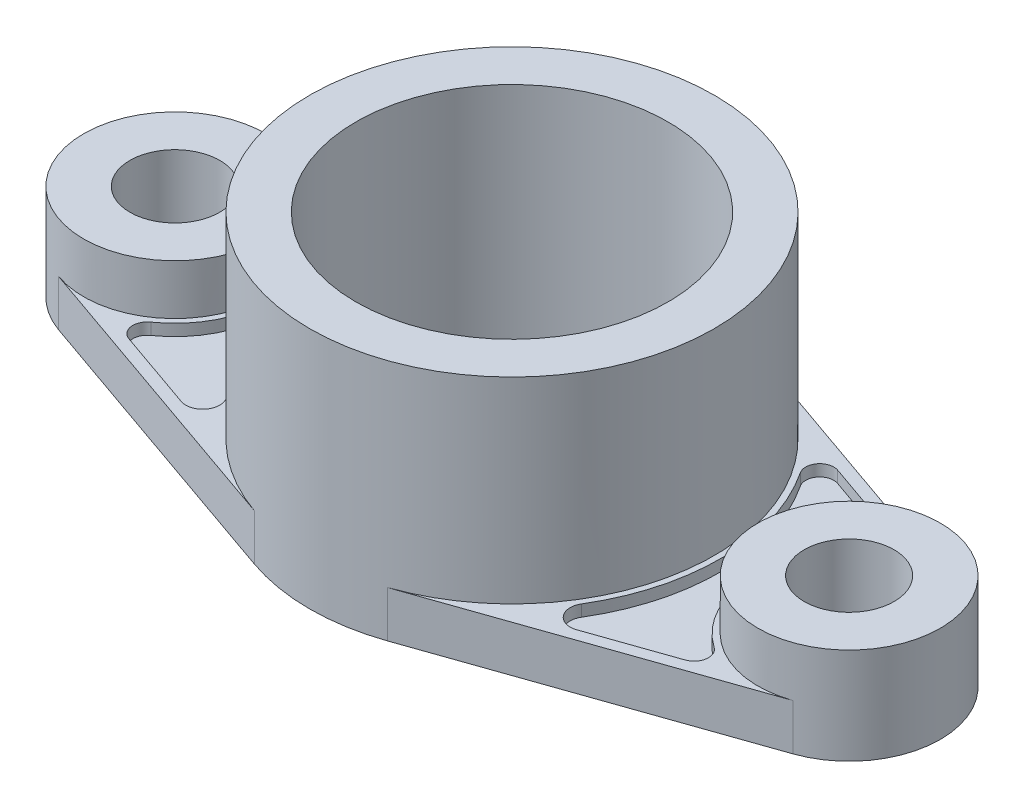
from build123d import *

# Parameters (mm, degrees)
BOSS_EXTRUDE1_DEPTH   = 12
BOSS_EXTRUDE1_2_DEPTH = 12
BOSS_EXTRUDE2_DEPTH   = 9
SKETCH1_4_R           = 40.5
BOSS_EXTRUDE3_DEPTH   = 63
SKETCH1_5_R           = 23.665
SKETCH1_5_R_2         = 11.665
BOSS_EXTRUDE4_DEPTH   = 25


with BuildPart() as part:
    # Sketch1 → Boss-Extrude1 (new body)
    with BuildSketch(Plane(origin=(0, 0, 0), x_dir=(1, 0, 0), z_dir=(0, 1, 0))):
        with BuildLine():
            ThreePointArc((-17.301, -49.56738241), (-52.5, 0), (-17.301, 49.56738241))
            Line((-17.301, 49.56738241), (-95.298631714, 22.343087709))
            ThreePointArc((-95.298631714, 22.343087709), (-63.835, 0), (-95.298631714, -22.343087709))
            Line((-95.298631714, -22.343087709), (-17.301, -49.56738241))
        make_face()
        with BuildLine():
            Line((-73.061565244, 26.927220983), (-49.292435481, 35.22359844))
            ThreePointArc((-49.292435481, 35.22359844), (-45.21504533, 34.020913269), (-45.050715916, 29.773024628))
            ThreePointArc((-45.050715916, 29.773024628), (-53.990744033, 0.999779365), (-46.122102919, -28.084722223))
            ThreePointArc((-46.122102919, -28.084722223), (-46.457803099, -33.130049608), (-51.320741116, -34.515638607))
            Line((-51.320741116, -34.515638607), (-72.196764974, -27.229070884))
            ThreePointArc((-72.196764974, -27.229070884), (-74.665998298, -24.211578828), (-73.102729075, -20.639666056))
            ThreePointArc((-73.102729075, -20.639666056), (-62.338211107, 0.40200089), (-73.769413903, 21.089054754))
            ThreePointArc((-73.769413903, 21.089054754), (-75.234080861, 24.22863303), (-73.061565244, 26.927220983))
        make_face(mode=Mode.SUBTRACT)
    extrude(amount=BOSS_EXTRUDE1_DEPTH)



with BuildPart() as body_2:
    # Sketch1 → Boss-Extrude1 2 (new body)
    with BuildSketch(Plane(origin=(0, 0, 0), x_dir=(1, 0, 0), z_dir=(0, 1, 0))):
        with BuildLine():
            Line((95.298631714, 22.343087709), (17.301, 49.56738241))
            ThreePointArc((17.301, 49.56738241), (52.5, 0), (17.301, -49.56738241))
            Line((17.301, -49.56738241), (95.298631714, -22.343087709))
            ThreePointArc((95.298631714, -22.343087709), (63.835, 0), (95.298631714, 22.343087709))
        make_face()
        with BuildLine():
            ThreePointArc((73.102729075, -20.639666056), (74.665998298, -24.211578828), (72.196764974, -27.229070884))
            Line((72.196764974, -27.229070884), (51.320741116, -34.515638607))
            ThreePointArc((51.320741116, -34.515638607), (46.457803099, -33.130049608), (46.122102919, -28.084722223))
            ThreePointArc((46.122102919, -28.084722223), (53.990744033, 0.999779365), (45.050715916, 29.773024628))
            ThreePointArc((45.050715916, 29.773024628), (45.21504533, 34.020913269), (49.292435481, 35.22359844))
            Line((49.292435481, 35.22359844), (73.061565244, 26.927220983))
            ThreePointArc((73.061565244, 26.927220983), (75.234080861, 24.22863303), (73.769413903, 21.089054754))
            ThreePointArc((73.769413903, 21.089054754), (62.338211107, 0.40200089), (73.102729075, -20.639666056))
        make_face(mode=Mode.SUBTRACT)
    extrude(amount=BOSS_EXTRUDE1_2_DEPTH)


with BuildPart() as part_1:
    add(part.part)

    add(body_2.part)  # Boss-Extrude2 merges body 2
    # Sketch1<3> → Boss-Extrude2 (add)
    with BuildSketch(Plane(origin=(0, 0, 0), x_dir=(1, 0, 0), z_dir=(0, 1, 0))):
        with BuildLine():
            ThreePointArc((-45.050715916, 29.773024628), (-45.21504533, 34.020913269), (-49.292435481, 35.22359844))
            Line((-49.292435481, 35.22359844), (-73.061565244, 26.927220983))
            ThreePointArc((-73.061565244, 26.927220983), (-75.234080861, 24.22863303), (-73.769413903, 21.089054754))
            ThreePointArc((-73.769413903, 21.089054754), (-62.338211107, 0.40200089), (-73.102729075, -20.639666056))
            ThreePointArc((-73.102729075, -20.639666056), (-74.665998298, -24.211578828), (-72.196764974, -27.229070884))
            Line((-72.196764974, -27.229070884), (-51.320741116, -34.515638607))
            ThreePointArc((-51.320741116, -34.515638607), (-46.457803099, -33.130049608), (-46.122102919, -28.084722223))
            ThreePointArc((-46.122102919, -28.084722223), (-53.990744033, 0.999779365), (-45.050715916, 29.773024628))
        make_face()
        with BuildLine():
            Line((51.320741116, -34.515638607), (72.196764974, -27.229070884))
            ThreePointArc((72.196764974, -27.229070884), (74.665998298, -24.211578828), (73.102729075, -20.639666056))
            ThreePointArc((73.102729075, -20.639666056), (62.338211107, 0.40200089), (73.769413903, 21.089054754))
            ThreePointArc((73.769413903, 21.089054754), (75.234080861, 24.22863303), (73.061565244, 26.927220983))
            Line((73.061565244, 26.927220983), (49.292435481, 35.22359844))
            ThreePointArc((49.292435481, 35.22359844), (45.21504533, 34.020913269), (45.050715916, 29.773024628))
            ThreePointArc((45.050715916, 29.773024628), (53.990744033, 0.999779365), (46.122102919, -28.084722223))
            ThreePointArc((46.122102919, -28.084722223), (46.457803099, -33.130049608), (51.320741116, -34.515638607))
        make_face()
    extrude(amount=BOSS_EXTRUDE2_DEPTH)

    # Sketch1<4> → Boss-Extrude3 (add)
    with BuildSketch(Plane(origin=(0, 0, 0), x_dir=(1, 0, 0), z_dir=(0, 1, 0))):
        with BuildLine():
            ThreePointArc((17.301, 49.56738241), (0, 52.5), (-17.301, 49.56738241))
            ThreePointArc((-17.301, 49.56738241), (-52.5, 0), (-17.301, -49.56738241))
            ThreePointArc((-17.301, -49.56738241), (0, -52.5), (17.301, -49.56738241))
            ThreePointArc((17.301, -49.56738241), (42.805096075, -30.396936523), (52.5, 0))
            ThreePointArc((52.5, 0), (42.805096075, 30.396936523), (17.301, 49.56738241))
        make_face()
        Circle(SKETCH1_4_R, mode=Mode.SUBTRACT)
    extrude(amount=BOSS_EXTRUDE3_DEPTH)

    # Sketch1<5> → Boss-Extrude4 (add)
    # profile 1 of 2: a face of its own
    with BuildSketch(Plane(origin=(0, 0, 0), x_dir=(1, 0, 0), z_dir=(0, 1, 0))):
        with Locations((-87.5, 0)):
            Circle(SKETCH1_5_R)
        with Locations((-87.5, 0)):
            Circle(SKETCH1_5_R_2, mode=Mode.SUBTRACT)
    # profile 2 of 2: a face of its own
    with BuildSketch(Plane(origin=(0, 0, 0), x_dir=(1, 0, 0), z_dir=(0, 1, 0))):
        with Locations((87.5, 0)):
            Circle(SKETCH1_5_R)
        with Locations((87.5, 0)):
            Circle(SKETCH1_5_R_2, mode=Mode.SUBTRACT)
    extrude(amount=BOSS_EXTRUDE4_DEPTH)


solid = part_1.part
